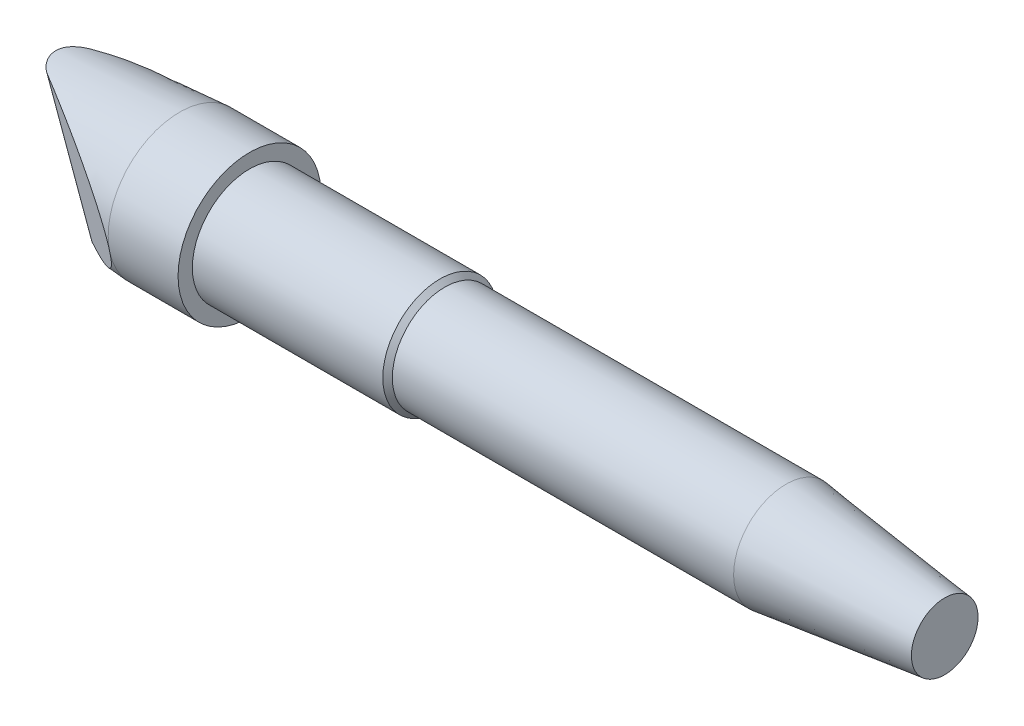
from build123d import *

# Parameters (mm, degrees)
CORTE_EXTRUS_O2_DEPTH = 5
CORTE_EXTRUS_O1_DEPTH = 10


with BuildPart() as part:
    # Esboço1 → Revolução1 (revolve)
    with BuildSketch(Plane.XY, mode=Mode.PRIVATE) as revolu_o1_sk:
        Polygon((6.2, 2.25), (6.2, 1.8), (12.2, 1.8), (12.35, 1.65), (23.1, 1.65), (28.1, 1.05), (28.1, 0), (0, 0), (0, 1.970292752), (4, 2.25), (4.7, 2.25), align=None)
    revolve(revolu_o1_sk.sketch.rotate(Axis((0, 0, 0), (1, 0, 0)), 90), axis=Axis((0, 0, 0), (1, 0, 0)))

    # Esboço2 → Corte-extrusão2 (cut, symmetric)
    with BuildSketch(Plane.XY):
        Polygon((0, 1.970292752), (1.471712801, -2.073204936), (2.326234143, -4.420983029), (-0.931248246, -4.420983029), (-0.931248246, 3.056454726), (-0.395330628, 3.056454726), align=None)
    extrude(amount=CORTE_EXTRUS_O2_DEPTH, both=True, mode=Mode.SUBTRACT)

    # Esboço3 → Corte-extrusão1 (cut, along a direction that is not the sketch's normal)
    with BuildSketch(Plane(origin=(3.863561719, 2.25, 0), x_dir=(0, 0, -1), z_dir=(0, 1, 0))):
        with BuildLine():
            Line((-4.503319596, -3.136438281), (-0.692801568, 3.463572547))
            ThreePointArc((-0.692801568, 3.463572547), (0, 3.863561719), (0.692801568, 3.463572547))
            Line((0.692801568, 3.463572547), (4.503319596, -3.136438281))
            ThreePointArc((4.503319596, -3.136438281), (0, 13.670179255), (-4.503319596, -3.136438281))
        make_face()
    extrude(amount=-CORTE_EXTRUS_O1_DEPTH, dir=(-0.3420201433256694, 0.9396926207859082, 0), mode=Mode.SUBTRACT)


solid = part.part
